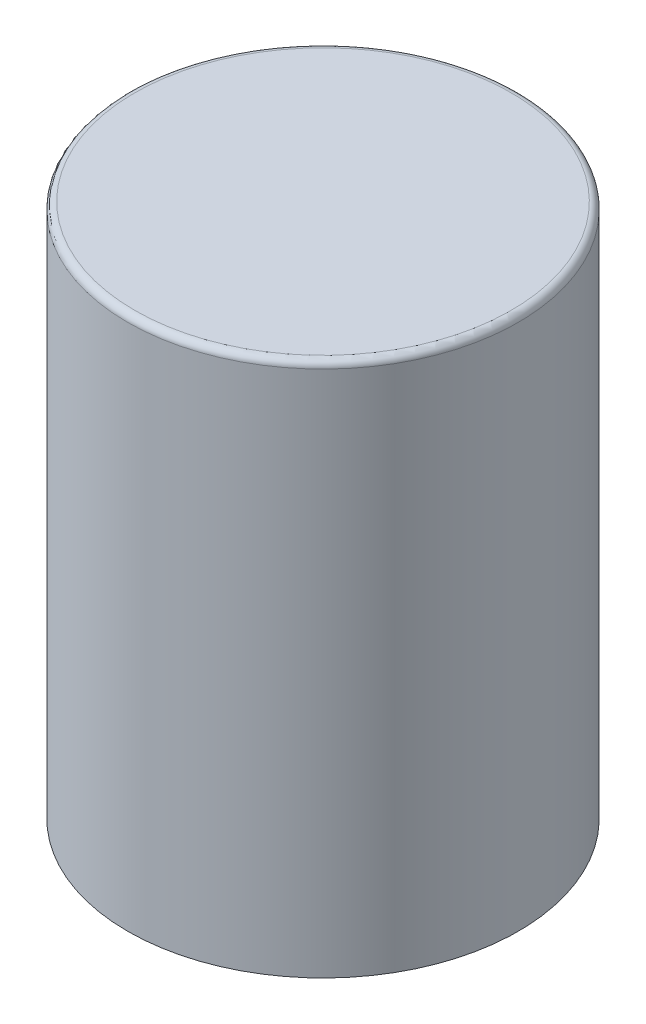
from build123d import *

# Parameters (mm, degrees)
SKETCH2_R          = 29.716008705
CUT_EXTRUDE1_DEPTH = 3
FILLET1_R          = 1


with BuildPart() as part:
    # Sketch1 → Revolve1 (revolve)
    with BuildSketch(Plane.XY, mode=Mode.PRIVATE) as revolve1_sk:
        Polygon((543.090410183, 122.80292457), (571.090410183, 122.80292457), (571.090410183, 43.204678726), (552.249882464, 43.204678726), (546.251643979, 44.096308771), (543.090410183, 45.879568862), align=None)
    revolve(revolve1_sk.sketch.rotate(Axis((571.090410183, 122.80292457, 0), (0, -1, 0)), 270), axis=Axis((571.090410183, 122.80292457, 0), (0, -1, 0)))

    # Sketch2 → Cut-Extrude1 (cut)
    with BuildSketch(Plane(origin=(0, 43.204678726, 0), x_dir=(-1, 0, 0), z_dir=(0, -1, 0))):
        with Locations((-571.090410183, 0)):
            Circle(SKETCH2_R)
    extrude(amount=-CUT_EXTRUDE1_DEPTH, mode=Mode.SUBTRACT)

    # Fillet1
    fillet1_edges = [part.edges().sort_by_distance(p)[0] for p in [
        (571.090410183, 122.80292457, -28),
    ]]
    fillet(fillet1_edges, radius=FILLET1_R)


solid = part.part
